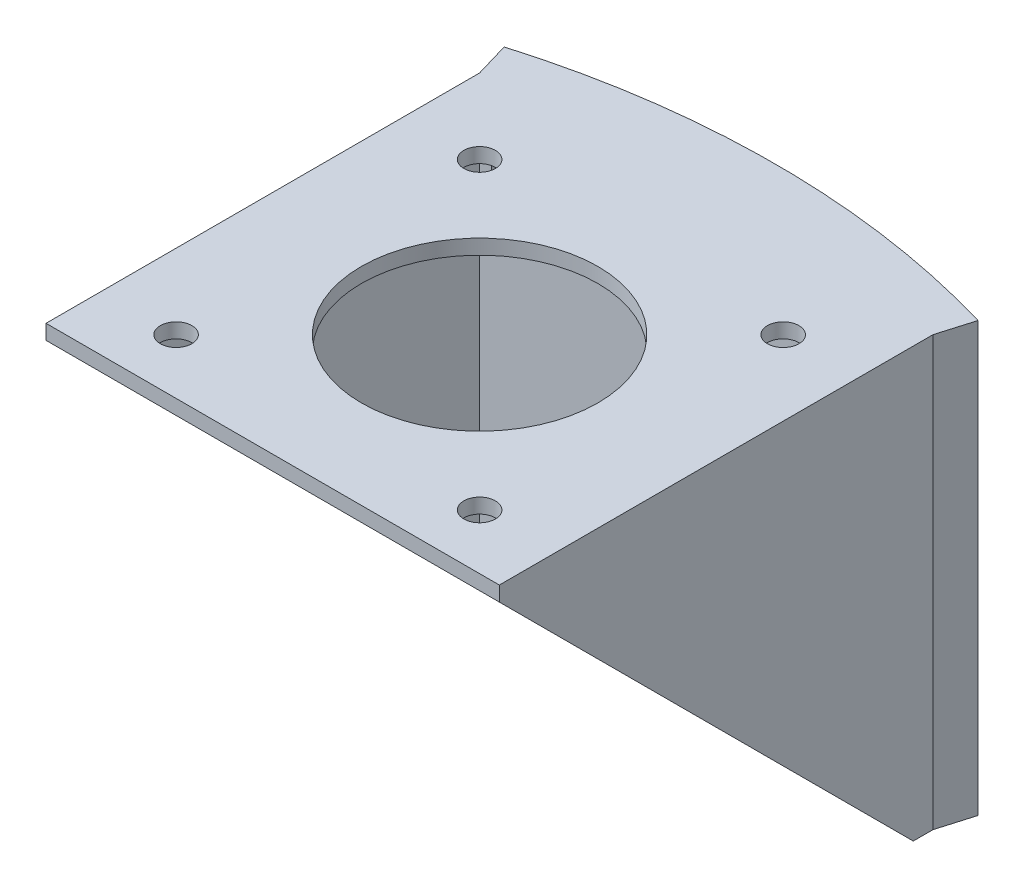
from build123d import *

# Parameters (mm, degrees)
SKETCH4_W                                  = 42
SKETCH4_H                                  = 42
SKETCH4_R                                  = 1.6
BOSS_EXTRUDE1_DEPTH                        = 1.5
SKETCH5_R                                  = 12
CUT_EXTRUDE1_DEPTH                         = 30.736341402
BOSS_EXTRUDE2_DEPTH                        = 2
SKETCH7_W                                  = 46
SKETCH7_H                                  = 43.5
BOSS_EXTRUDE3_DEPTH                        = 2
CUT_EXTRUDE2_DEPTH                         = 0.2
SKETCH9_W                                  = 42.4
SKETCH9_H                                  = 42
CUT_EXTRUDE3_DEPTH                         = 0.2
BOSS_EXTRUDE4_DEPTH                        = 43.5
SKETCH16_W                                 = 10
SKETCH16_H                                 = 5
CUT_EXTRUDE6_DEPTH                         = 12
SKETCH12_R                                 = 1.6
CUT_EXTRUDE8_DEPTH                         = 65.209004806
SKETCH18_R                                 = 3.6
CUT_EXTRUDE9_DEPTH                         = 1.5
MIRROR7_AT_THE_SECOND_PLANE_COPY_1_SKETC_R = 3.6
MIRROR7_AT_THE_SECOND_PLANE_COPY_1_DEPTH   = 1.5
CUT_EXTRUDE10_REACH                        = 66.209
CUT_EXTRUDE10_END_RADIUS                   = 85
SKETCH22_R                                 = 1.6


with BuildPart() as part:
    # Sketch4 → Boss-Extrude1 (new body)
    with BuildSketch(Plane(origin=(0, 0, 0), x_dir=(1, 0, 0), z_dir=(0, 1, 0))):
        Rectangle(SKETCH4_W, SKETCH4_H)
        with Locations(Location((-15.4, 15.4, 0), (0, 0, 270))):
            Circle(SKETCH4_R, mode=Mode.SUBTRACT)
        with Locations(Location((15.4, 15.4, 0), (0, 0, 90))):
            Circle(SKETCH4_R, mode=Mode.SUBTRACT)
        with Locations(Location((15.4, -15.4, 0), (0, 0, 270))):
            Circle(SKETCH4_R, mode=Mode.SUBTRACT)
        with Locations(Location((-15.4, -15.4, 0), (0, 0, 90))):
            Circle(SKETCH4_R, mode=Mode.SUBTRACT)
    extrude(amount=BOSS_EXTRUDE1_DEPTH)

    # Sketch5 → Cut-Extrude1 (cut, through all)
    with BuildSketch(Plane(origin=(0, 1.5, 0), x_dir=(1, 0, 0), z_dir=(0, 1, 0))):
        with Locations(Location((0, 0, 0), (0, 0, 270))):
            Circle(SKETCH5_R)
    extrude(amount=-CUT_EXTRUDE1_DEPTH, mode=Mode.SUBTRACT)

    # Sketch6 → Boss-Extrude2 (add)
    with BuildSketch(Plane(origin=(21, 0, 0), x_dir=(0, 0, -1), z_dir=(1, 0, 0))):
        Polygon((-21, 0), (21, -42), (21, 0), (21, 1.5), (-21, 1.5), align=None)
    boss_extrude2 = extrude(amount=BOSS_EXTRUDE2_DEPTH)

    # Mirror1: Boss-Extrude2 across plane
    add(boss_extrude2.mirror(Plane(origin=(0, 0, 0), x_dir=(0, 0, 1), z_dir=(1, 0, 0))))

    # Sketch7 → Boss-Extrude3 (add)
    with BuildSketch(Plane(origin=(0, 0, -21), x_dir=(-1, 0, 0), z_dir=(0, 0, -1))):
        with Locations((0, -20.25)):
            Rectangle(SKETCH7_W, SKETCH7_H)
    extrude(amount=BOSS_EXTRUDE3_DEPTH)

    # Sketch8 → Cut-Extrude2 (cut)
    with BuildSketch(Plane(origin=(-21, 0, 0), x_dir=(0, 0, -1), z_dir=(1, 0, 0))):
        Polygon((-21, 0), (21, -42), (21, 0), align=None)
    cut_extrude2 = extrude(amount=-CUT_EXTRUDE2_DEPTH, mode=Mode.SUBTRACT)

    # Mirror2: Cut-Extrude2 across plane
    add(cut_extrude2.mirror(Plane(origin=(0, 0, 0), x_dir=(0, 0, 1), z_dir=(1, 0, 0))), mode=Mode.SUBTRACT)

    # Sketch9 → Cut-Extrude3 (cut)
    with BuildSketch(Plane.XY.offset(-21)):
        with Locations((0, -21)):
            Rectangle(SKETCH9_W, SKETCH9_H)
    extrude(amount=-CUT_EXTRUDE3_DEPTH, mode=Mode.SUBTRACT)

    # Sketch14 → Boss-Extrude4 (add)
    with BuildSketch(Plane(origin=(0, 1.5, 0), x_dir=(1, 0, 0), z_dir=(0, 1, 0))):
        with BuildLine():
            Line((-23, 23), (23, 23))
            Line((23, 23), (24.040721666, 26.529403909))
            ThreePointArc((24.040721666, 26.529403909), (0, 30), (-24.040721666, 26.529403909))
            Line((-24.040721666, 26.529403909), (-23, 23))
        make_face()
    extrude(amount=-BOSS_EXTRUDE4_DEPTH)

    # Sketch16 → Cut-Extrude6 (cut)
    with BuildSketch(Plane.XZ.offset(42)):
        with Locations((0, -23.7)):
            Rectangle(SKETCH16_W, SKETCH16_H)
    extrude(amount=-CUT_EXTRUDE6_DEPTH, mode=Mode.SUBTRACT)

    # Sketch12 → Cut-Extrude8 (cut, through all)
    with BuildSketch(Plane.XY.offset(-21.2)):
        with Locations((16.4, -4.6)):
            Circle(SKETCH12_R)
    extrude(amount=-CUT_EXTRUDE8_DEPTH, mode=Mode.SUBTRACT)

    # Sketch18 → Cut-Extrude9 (cut)
    with BuildSketch(Plane.XY.offset(-21.2)):
        with Locations((16.4, -4.6)):
            Circle(SKETCH18_R)
    cut_extrude9 = extrude(amount=-CUT_EXTRUDE9_DEPTH, mode=Mode.SUBTRACT)

    # Mirror7: Cut-Extrude9 across plane
    add(cut_extrude9.mirror(Plane(origin=(0, -21, 0), x_dir=(0, 0, 1), z_dir=(0, -1, 0))), mode=Mode.SUBTRACT)

    # Mirror7 at the second plane: Cut-Extrude9 across plane
    add(cut_extrude9.mirror(Plane(origin=(0, 0, 0), x_dir=(0, 0, 1), z_dir=(1, 0, 0))), mode=Mode.SUBTRACT)

    # Mirror7 at the second plane copy 1 sketc → Mirror7 at the second plane copy 1 (cut)
    with BuildSketch(Plane(origin=(0, -42, -21.2), x_dir=(-1, 0, 0), z_dir=(0, 0, 1))):
        with Locations((16.4, -4.6)):
            Circle(MIRROR7_AT_THE_SECOND_PLANE_COPY_1_SKETC_R)
    extrude(amount=-MIRROR7_AT_THE_SECOND_PLANE_COPY_1_DEPTH, mode=Mode.SUBTRACT)

    # Cut-Extrude10: up to this cylinder (the profile starts inside it)
    cut_extrude10_end = Plane(origin=(0, -21, 55), z_dir=(0, 1, 0)) * Cylinder(CUT_EXTRUDE10_END_RADIUS, 336.218, mode=Mode.PRIVATE)
    # Sketch22 → Cut-Extrude10 (cut, up to the surface)
    with BuildSketch(Plane.XY.offset(-21.2), mode=Mode.PRIVATE) as cut_extrude10_sk1:
        with Locations((-16.4, -37.4)):
            Circle(SKETCH22_R)
    cut_extrude10_tool1 = extrude(cut_extrude10_sk1.sketch, amount=-CUT_EXTRUDE10_REACH, mode=Mode.PRIVATE) & cut_extrude10_end
    add(cut_extrude10_tool1.solids().sort_by_distance((-16.4, -37.4, -21.2))[0], mode=Mode.SUBTRACT)
    # Sketch22 → Cut-Extrude10 (cut, up to the surface)
    with BuildSketch(Plane.XY.offset(-21.2), mode=Mode.PRIVATE) as cut_extrude10_sk2:
        with Locations((-16.4, -4.6)):
            Circle(SKETCH22_R)
    cut_extrude10_tool2 = extrude(cut_extrude10_sk2.sketch, amount=-CUT_EXTRUDE10_REACH, mode=Mode.PRIVATE) & cut_extrude10_end
    add(cut_extrude10_tool2.solids().sort_by_distance((-16.4, -4.6, -21.2))[0], mode=Mode.SUBTRACT)
    # Sketch22 → Cut-Extrude10 (cut, up to the surface)
    with BuildSketch(Plane.XY.offset(-21.2), mode=Mode.PRIVATE) as cut_extrude10_sk3:
        with Locations((16.4, -37.4)):
            Circle(SKETCH22_R)
    cut_extrude10_tool3 = extrude(cut_extrude10_sk3.sketch, amount=-CUT_EXTRUDE10_REACH, mode=Mode.PRIVATE) & cut_extrude10_end
    add(cut_extrude10_tool3.solids().sort_by_distance((16.4, -37.4, -21.2))[0], mode=Mode.SUBTRACT)


solid = part.part
